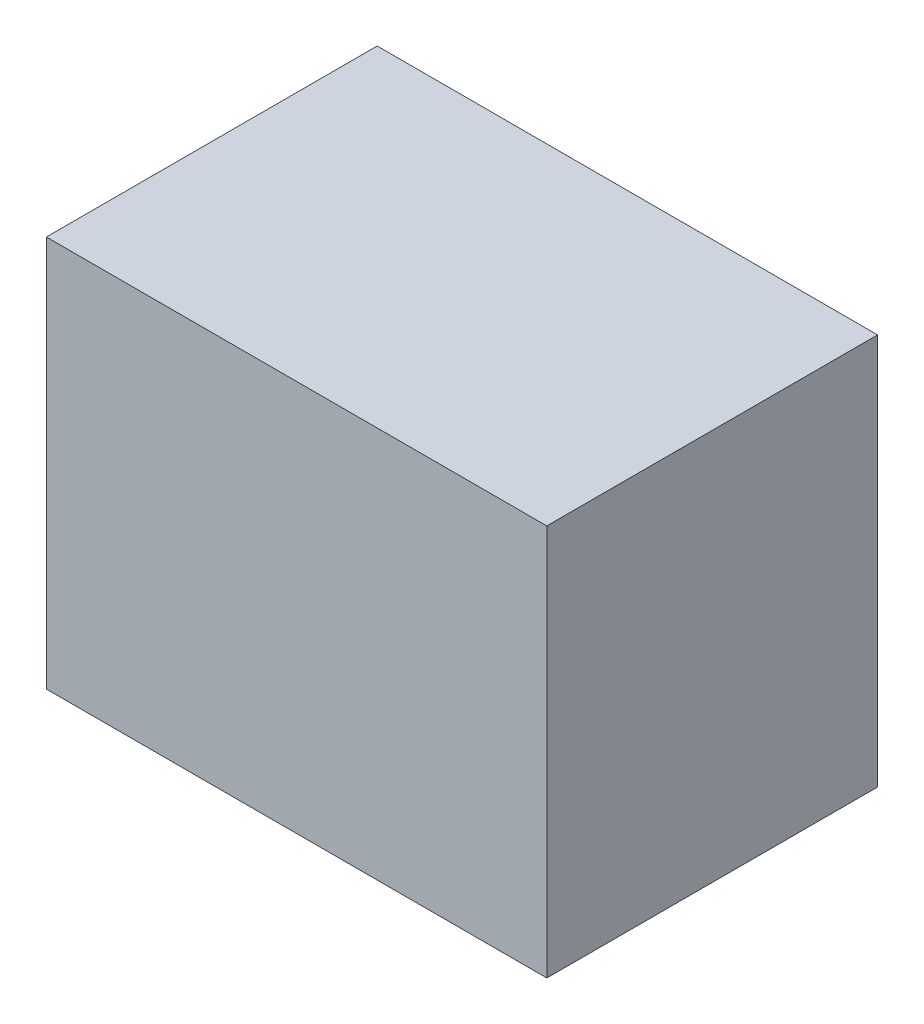
from build123d import *

# Parameters (mm, degrees)
SKETCH1_W           = 758.825
SKETCH1_H           = 593.725
BOSS_EXTRUDE1_DEPTH = 501.65


with BuildPart() as part:
    # Sketch1 → Boss-Extrude1 (new body)
    with BuildSketch(Plane.XY):
        with Locations((325.271160966, 261.733584673)):
            Rectangle(SKETCH1_W, SKETCH1_H)
    extrude(amount=BOSS_EXTRUDE1_DEPTH)


solid = part.part
